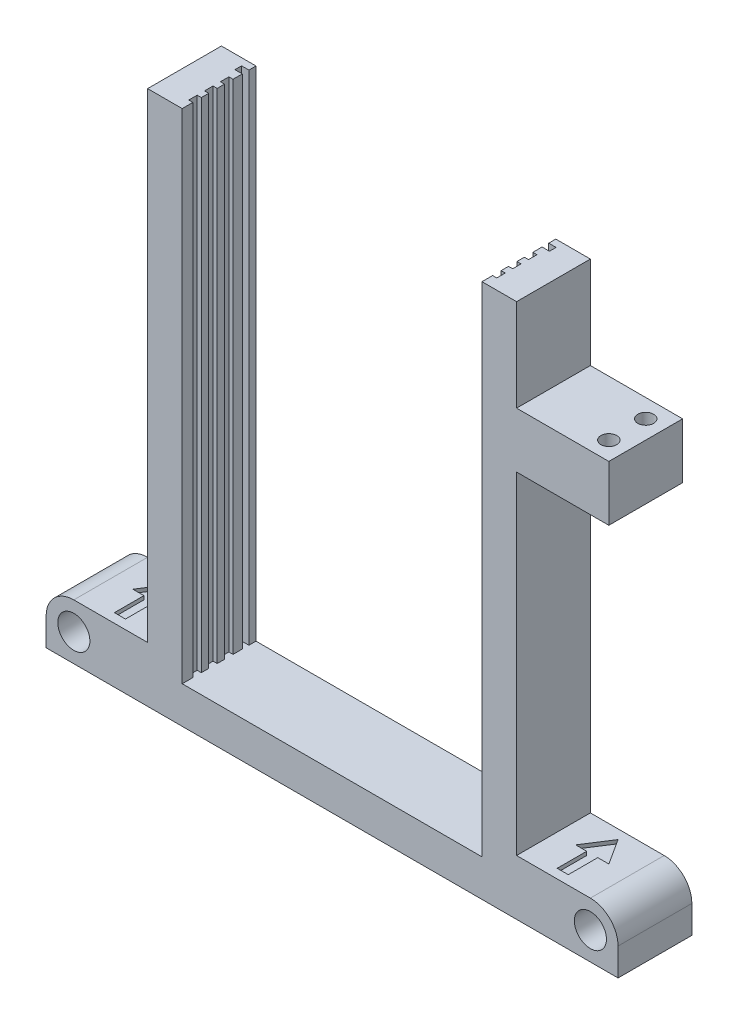
from build123d import *

# Parameters (mm, degrees)
SKETCH1_R                 = 4.35
BOSS_EXTRUDE1_DEPTH       = 10
CUT_EXTRUDE1_DEPTH        = 135
SKETCH3_W                 = 83.5
SKETCH3_H                 = 2.3
CUT_EXTRUDE2_DEPTH        = 135
LPATTERN1_COUNT           = 3
LPATTERN1_PITCH           = 4.3
CUT_EXTRUDE3_DEPTH        = 1
SKETCH5_W                 = 25
SKETCH5_H                 = 15
BOSS_EXTRUDE2_DEPTH       = 20
F_6_CLEARANCE_HOLE1_D     = 4.3053
F_6_CLEARANCE_HOLE1_DEPTH = 20
F_6_CLEARANCE_HOLE1_TIP   = 1.293442612


with BuildPart() as part:
    # Sketch1 → Boss-Extrude1 (new, symmetric)
    with BuildSketch(Plane.XY):
        with BuildLine():
            Line((-77.5, 0), (77.5, 0))
            Line((77.5, 0), (77.5, 7.5))
            ThreePointArc((77.5, 7.5), (75.303300859, 12.803300859), (70, 15))
            Line((70, 15), (50, 15))
            Line((50, 15), (50, 145))
            Line((50, 145), (-50, 145))
            Line((-50, 145), (-50, 15))
            Line((-50, 15), (-70, 15))
            ThreePointArc((-70, 15), (-75.303300859, 12.803300859), (-77.5, 7.5))
            Line((-77.5, 7.5), (-77.5, 0))
        make_face()
        with Locations((-70, 7.5)):
            Circle(SKETCH1_R, mode=Mode.SUBTRACT)
        with Locations((70, 7.5)):
            Circle(SKETCH1_R, mode=Mode.SUBTRACT)
    extrude(amount=BOSS_EXTRUDE1_DEPTH, both=True)

    # Sketch2 → Cut-Extrude1 (cut)
    with BuildSketch(Plane(origin=(0, 145, 0), x_dir=(1, 0, 0), z_dir=(0, 1, 0))):
        Polygon((-40.625, -10), (-40.625, 6.28), (-42.625, 6.28), (-42.625, 8.08), (-40.625, 8.08), (-40.625, 10), (40.625, 10), (40.625, 8.08), (42.625, 8.08), (42.625, 6.28), (40.625, 6.28), (40.625, -10), align=None)
    extrude(amount=-CUT_EXTRUDE1_DEPTH, mode=Mode.SUBTRACT)

    # Sketch3 → Cut-Extrude2 (cut)
    with BuildSketch(Plane(origin=(0, 145, 0), x_dir=(1, 0, 0), z_dir=(0, 1, 0))):
        with Locations((0, 2.63)):
            Rectangle(SKETCH3_W, SKETCH3_H)
    cut_extrude2 = extrude(amount=-CUT_EXTRUDE2_DEPTH, mode=Mode.SUBTRACT)

    # LPattern1: Cut-Extrude2 ×3
    with Locations(*[(0, 0, i * LPATTERN1_PITCH) for i in range(1, LPATTERN1_COUNT)]):
        add(cut_extrude2, mode=Mode.SUBTRACT)

    # Sketch4 → Cut-Extrude3 (cut)
    with BuildSketch(Plane(origin=(0, 15, 0), x_dir=(1, 0, 0), z_dir=(0, 1, 0))):
        Polygon((60, 7.5), (55.5, 0.5), (58.5, 0.5), (58.5, -7.5), (61.5, -7.5), (61.5, 0.5), (64.5, 0.5), align=None)
    cut_extrude3 = extrude(amount=-CUT_EXTRUDE3_DEPTH, mode=Mode.SUBTRACT)

    # Mirror1: Cut-Extrude3 across plane
    add(cut_extrude3.mirror(Plane(origin=(0, 0, 0), x_dir=(0, 0, 1), z_dir=(1, 0, 0))), mode=Mode.SUBTRACT)

    # Sketch5 → Boss-Extrude2 (add)
    with BuildSketch(Plane(origin=(0, 0, -10), x_dir=(-1, 0, 0), z_dir=(0, 0, -1))):
        with Locations((-62.5, 112.5)):
            Rectangle(SKETCH5_W, SKETCH5_H)
    extrude(amount=-BOSS_EXTRUDE2_DEPTH)

    # #6 Clearance Hole1
    with Locations(Plane(origin=(0, 120, 0), x_dir=(1, 0, 0), z_dir=(0, 1, 0))):
        with Locations((70, 5), (70, -5)):
            Hole(F_6_CLEARANCE_HOLE1_D / 2, depth=F_6_CLEARANCE_HOLE1_DEPTH)
            with Locations((0, 0, -(F_6_CLEARANCE_HOLE1_DEPTH + F_6_CLEARANCE_HOLE1_TIP / 2))):  # 118° drill point
                Cone(0, F_6_CLEARANCE_HOLE1_D / 2, F_6_CLEARANCE_HOLE1_TIP, mode=Mode.SUBTRACT)


solid = part.part
